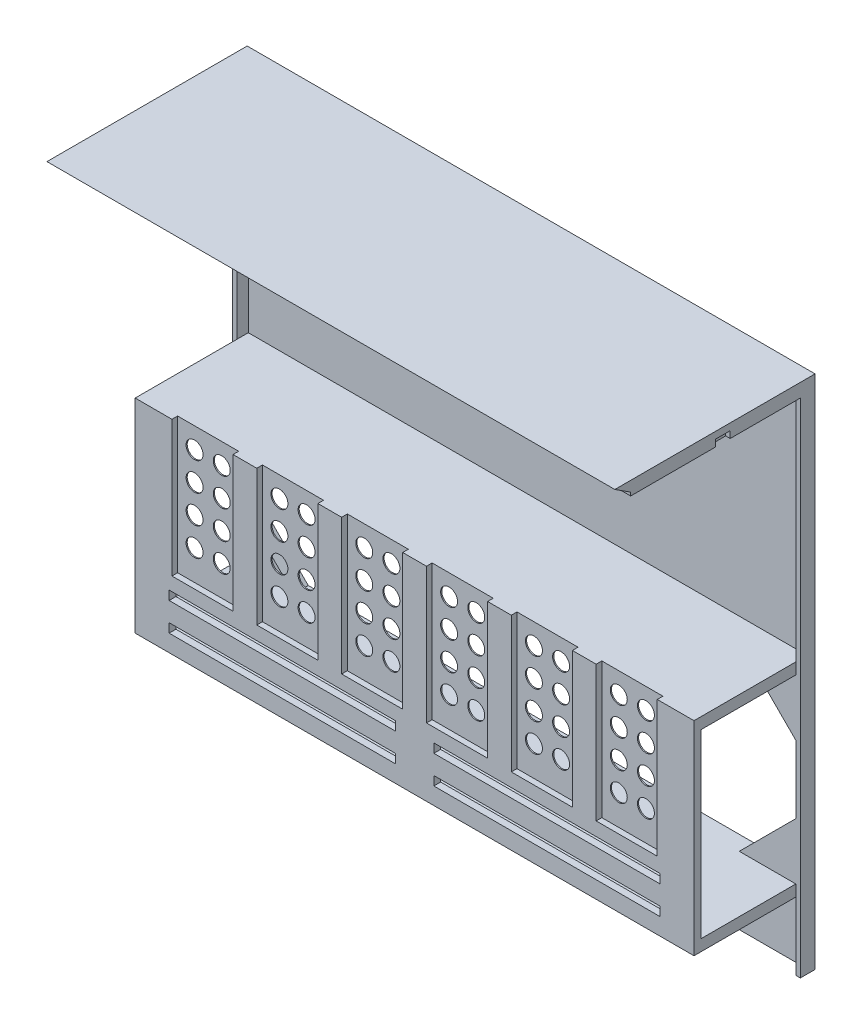
from build123d import *

# Parameters (mm, degrees)
BOSS_EXTRUDE1_DEPTH = 2.6
SKETCH2_W           = 100.4
SKETCH2_H           = 2.4
BOSS_EXTRUDE2_DEPTH = 30
LPATTERN1_COUNT     = 2
LPATTERN1_PITCH     = 15
SKETCH5_W           = 2.6
SKETCH5_H           = 2
BOSS_EXTRUDE4_DEPTH = 98.8
SKETCH7_W           = 0.8
SKETCH7_H           = 2.6
CUT_EXTRUDE1_DEPTH  = 90
SKETCH8_W           = 0.8
SKETCH8_H           = 2.6
CUT_EXTRUDE2_DEPTH  = 90
BOSS_EXTRUDE5_DEPTH = 100.4
SKETCH11_W          = 10.8
SKETCH11_H          = 24
CUT_EXTRUDE3_DEPTH  = 1
LPATTERN2_COUNT     = 6
LPATTERN2_PITCH     = 15
SKETCH13_W          = 98.8
SKETCH13_H          = 32
CUT_EXTRUDE4_DEPTH  = 10
CHAMFER1_SIZE       = 10
SKETCH15_R          = 1.5
CUT_EXTRUDE17_DEPTH = 10
SKETCH18_W          = 40
SKETCH18_H          = 1.6
CUT_EXTRUDE18_DEPTH = 10


with BuildPart() as part:
    # Sketch1 → Boss-Extrude1 (new body)
    with BuildSketch(Plane.XY):
        Polygon((-13.007233288, 0), (-13.007233288, 90), (85.792766712, 90), (85.792766712, 0), (86.592766712, 0), (86.592766712, 91.2), (-13.807233288, 91.2), (-13.807233288, 0), align=None)
    boss_extrude1 = extrude(amount=BOSS_EXTRUDE1_DEPTH)

    # Sketch2 → Boss-Extrude2 (add)
    with BuildSketch(Plane.XY.offset(2.6)):
        with Locations((36.392766712, 90)):
            Rectangle(SKETCH2_W, SKETCH2_H)
    extrude(amount=BOSS_EXTRUDE2_DEPTH)

    # LPattern1: Boss-Extrude1 ×2
    with Locations(*[(0, 0, i * LPATTERN1_PITCH) for i in range(1, LPATTERN1_COUNT)]):
        add(boss_extrude1)

    # Sketch5 → Boss-Extrude4 (add)
    with BuildSketch(Plane.ZY.offset(-85.792766712)):
        Polygon((20.6, 12), (20.6, 48), (17.6, 48), (17.6, 46), (19.4, 46), (19.4, 14), (17.6, 14), (17.6, 12), align=None)
        Polygon((15, 46), (15, 48), (5.6, 48), (0.6, 48), (0.6, 90), (0, 90), (0, 48.076108626), (0, 12.076108626), (0, 0), (0.6, 0), (0.6, 12), (5.6, 12), (15, 12), (15, 14), (0.6, 14), (0.6, 46), align=None)
        with Locations((16.3, 13)):
            Rectangle(SKETCH5_W, SKETCH5_H)
        with Locations((16.3, 47)):
            Rectangle(SKETCH5_W, SKETCH5_H)
    extrude(amount=BOSS_EXTRUDE4_DEPTH)

    # Sketch7 → Cut-Extrude1 (cut)
    with BuildSketch(Plane.XZ):
        with Locations((-13.407233288, 16.3)):
            Rectangle(SKETCH7_W, SKETCH7_H)
    extrude(amount=-CUT_EXTRUDE1_DEPTH, mode=Mode.SUBTRACT)

    # Sketch8 → Cut-Extrude2 (cut)
    with BuildSketch(Plane.XZ):
        with Locations((86.192766712, 16.3)):
            Rectangle(SKETCH8_W, SKETCH8_H)
    extrude(amount=-CUT_EXTRUDE2_DEPTH, mode=Mode.SUBTRACT)

    # Sketch10 → Boss-Extrude5 (add)
    with BuildSketch(Plane(origin=(86.592766712, 0, 0), x_dir=(0, 0, -1), z_dir=(1, 0, 0))):
        Polygon((-35.4, 91.2), (-32.6, 89.4), (-32.6, 91.2), align=None)
    extrude(amount=-BOSS_EXTRUDE5_DEPTH)

    # Sketch11 → Cut-Extrude3 (cut)
    with BuildSketch(Plane.XY.offset(20.6)):
        with Locations((-1.107233288, 36)):
            Rectangle(SKETCH11_W, SKETCH11_H)
    cut_extrude3 = extrude(amount=-CUT_EXTRUDE3_DEPTH, mode=Mode.SUBTRACT)

    # LPattern2: Cut-Extrude3 ×6
    with Locations(*[(i * LPATTERN2_PITCH, 0, 0) for i in range(1, LPATTERN2_COUNT)]):
        add(cut_extrude3, mode=Mode.SUBTRACT)

    # Sketch13 → Cut-Extrude4 (cut)
    with BuildSketch(Plane.XY.offset(0.6)):
        with Locations((36.392766712, 30)):
            Rectangle(SKETCH13_W, SKETCH13_H)
    extrude(amount=-CUT_EXTRUDE4_DEPTH, mode=Mode.SUBTRACT)

    # Chamfer1
    chamfer1_edges = [part.edges().sort_by_distance(p)[0] for p in [
        (85.792766712, 46, 1.3),
        (-13.007233288, 14, 1.3),
        (-13.007233288, 46, 1.3),
        (85.792766712, 14, 1.3),
    ]]
    chamfer(chamfer1_edges, length=CHAMFER1_SIZE)

    # Sketch15 → Cut-Extrude17 (cut)
    with BuildSketch(Plane.XY.offset(19.6)):
        with Locations((-3.507233288, 44.31513876)):
            Circle(SKETCH15_R)
        with Locations((1.292766712, 44.31513876)):
            Circle(SKETCH15_R)
        with Locations((11.492766712, 44.31513876)):
            Circle(SKETCH15_R)
        with Locations((16.292766712, 44.31513876)):
            Circle(SKETCH15_R)
        with Locations((26.492766712, 44.31513876)):
            Circle(SKETCH15_R)
        with Locations((31.292766712, 44.31513876)):
            Circle(SKETCH15_R)
        with Locations((41.492766712, 44.31513876)):
            Circle(SKETCH15_R)
        with Locations((46.292766712, 44.31513876)):
            Circle(SKETCH15_R)
        with Locations((56.492766712, 44.31513876)):
            Circle(SKETCH15_R)
        with Locations((61.292766712, 44.31513876)):
            Circle(SKETCH15_R)
        with Locations((71.492766712, 44.31513876)):
            Circle(SKETCH15_R)
        with Locations((76.292766712, 44.31513876)):
            Circle(SKETCH15_R)
        with Locations((11.492766712, 39.31513876)):
            Circle(SKETCH15_R)
        with Locations((16.292766712, 39.31513876)):
            Circle(SKETCH15_R)
        with Locations((26.492766712, 39.31513876)):
            Circle(SKETCH15_R)
        with Locations((31.292766712, 39.31513876)):
            Circle(SKETCH15_R)
        with Locations((41.492766712, 39.31513876)):
            Circle(SKETCH15_R)
        with Locations((46.292766712, 39.31513876)):
            Circle(SKETCH15_R)
        with Locations((56.492766712, 39.31513876)):
            Circle(SKETCH15_R)
        with Locations((61.292766712, 39.31513876)):
            Circle(SKETCH15_R)
        with Locations((71.492766712, 39.31513876)):
            Circle(SKETCH15_R)
        with Locations((76.292766712, 39.31513876)):
            Circle(SKETCH15_R)
        with Locations((11.492766712, 34.31513876)):
            Circle(SKETCH15_R)
        with Locations((16.292766712, 34.31513876)):
            Circle(SKETCH15_R)
        with Locations((26.492766712, 34.31513876)):
            Circle(SKETCH15_R)
        with Locations((31.292766712, 34.31513876)):
            Circle(SKETCH15_R)
        with Locations((41.492766712, 34.31513876)):
            Circle(SKETCH15_R)
        with Locations((46.292766712, 34.31513876)):
            Circle(SKETCH15_R)
        with Locations((56.492766712, 34.31513876)):
            Circle(SKETCH15_R)
        with Locations((61.292766712, 34.31513876)):
            Circle(SKETCH15_R)
        with Locations((71.492766712, 34.31513876)):
            Circle(SKETCH15_R)
        with Locations((76.292766712, 34.31513876)):
            Circle(SKETCH15_R)
        with Locations((11.492766712, 29.31513876)):
            Circle(SKETCH15_R)
        with Locations((16.292766712, 29.31513876)):
            Circle(SKETCH15_R)
        with Locations((26.492766712, 29.31513876)):
            Circle(SKETCH15_R)
        with Locations((31.292766712, 29.31513876)):
            Circle(SKETCH15_R)
        with Locations((41.492766712, 29.31513876)):
            Circle(SKETCH15_R)
        with Locations((46.292766712, 29.31513876)):
            Circle(SKETCH15_R)
        with Locations((56.492766712, 29.31513876)):
            Circle(SKETCH15_R)
        with Locations((61.292766712, 29.31513876)):
            Circle(SKETCH15_R)
        with Locations((71.492766712, 29.31513876)):
            Circle(SKETCH15_R)
        with Locations((76.292766712, 29.31513876)):
            Circle(SKETCH15_R)
        with Locations((-3.507233288, 39.31513876)):
            Circle(SKETCH15_R)
        with Locations((1.292766712, 39.31513876)):
            Circle(SKETCH15_R)
        with Locations((-3.507233288, 34.31513876)):
            Circle(SKETCH15_R)
        with Locations((1.292766712, 34.31513876)):
            Circle(SKETCH15_R)
        with Locations((-3.507233288, 29.31513876)):
            Circle(SKETCH15_R)
        with Locations((1.292766712, 29.31513876)):
            Circle(SKETCH15_R)
    extrude(amount=-CUT_EXTRUDE17_DEPTH, mode=Mode.SUBTRACT)

    # Sketch18 → Cut-Extrude18 (cut)
    with BuildSketch(Plane.XY.offset(20.6)):
        with Locations((59.792766712, 20.8)):
            Rectangle(SKETCH18_W, SKETCH18_H)
        with Locations((12.992766712, 20.8)):
            Rectangle(SKETCH18_W, SKETCH18_H)
        with Locations((59.792766712, 15.8)):
            Rectangle(SKETCH18_W, SKETCH18_H)
        with Locations((12.992766712, 15.8)):
            Rectangle(SKETCH18_W, SKETCH18_H)
    extrude(amount=-CUT_EXTRUDE18_DEPTH, mode=Mode.SUBTRACT)


solid = part.part
